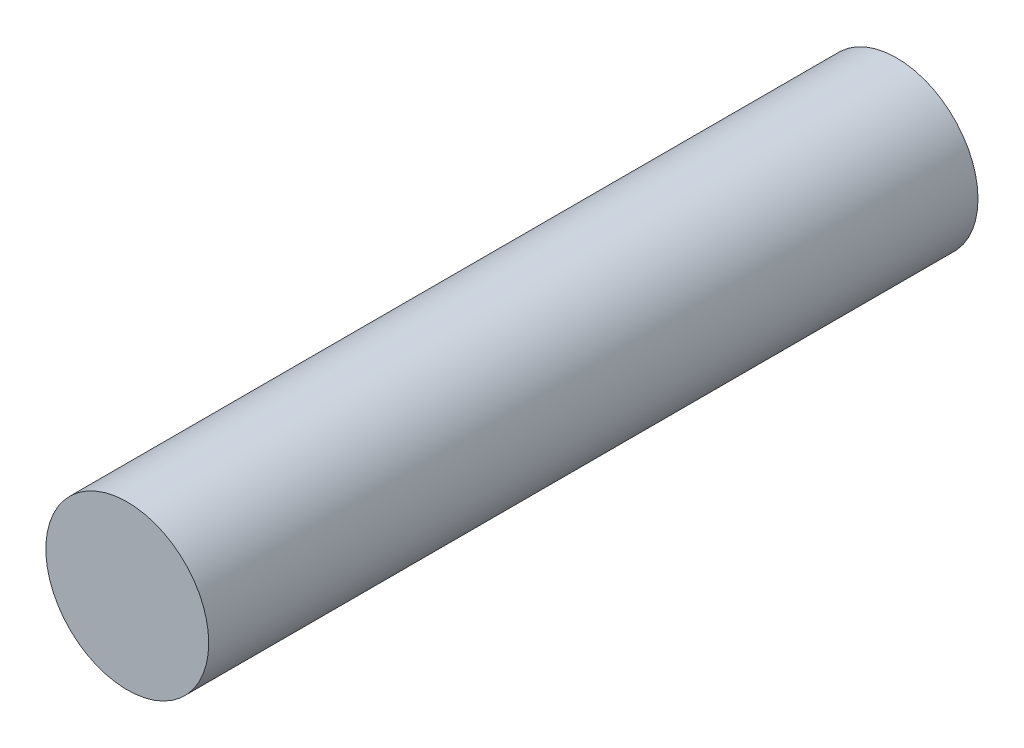
from build123d import *

# Parameters (mm, degrees)
CROQUIS1_R              = 7.94
SALIENTE_EXTRUIR1_DEPTH = 37.5


with BuildPart() as part:
    # Croquis1 → Saliente-Extruir1 (new, symmetric)
    with BuildSketch(Plane.XY):
        Circle(CROQUIS1_R)
    extrude(amount=SALIENTE_EXTRUIR1_DEPTH, both=True)


solid = part.part
